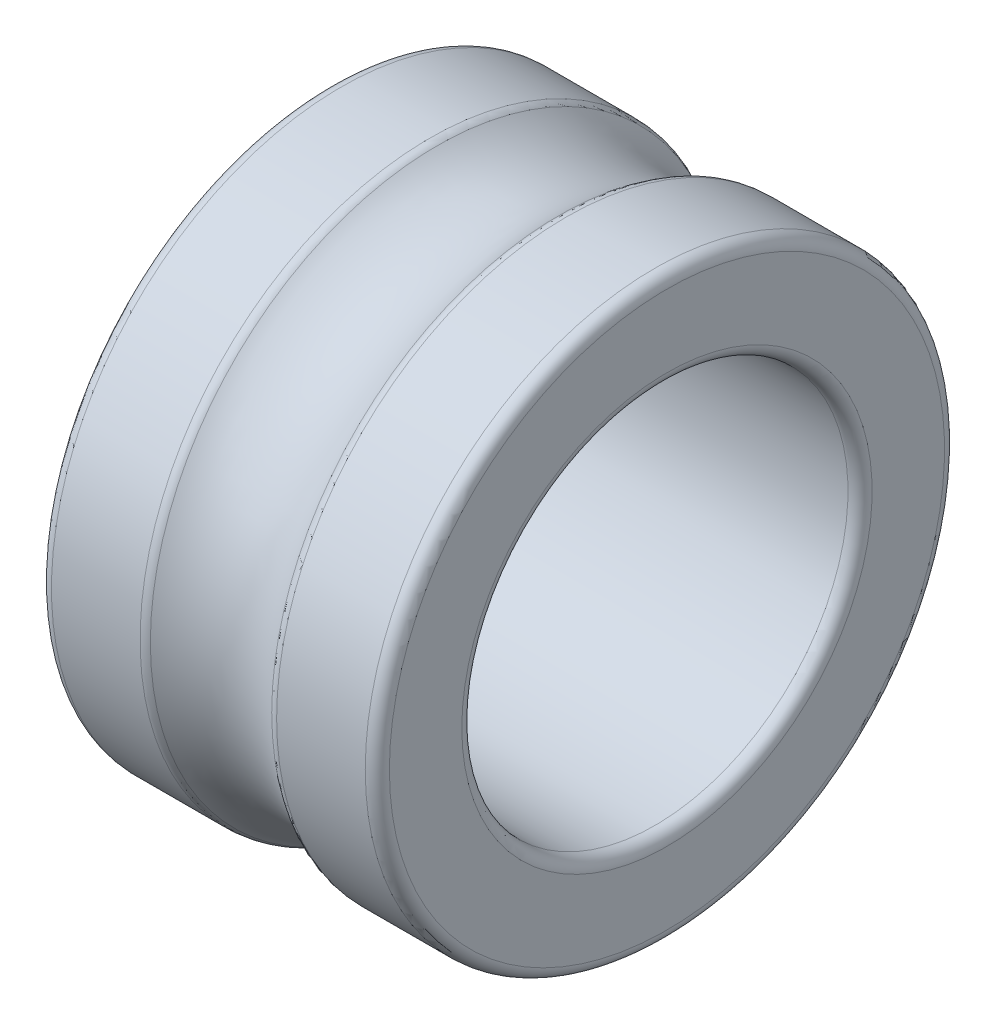
from build123d import *

# Parameters (mm, degrees)
CONG_1_R = 0.25


with BuildPart() as part:
    # Esquisse1 → Révolution1 (revolve)
    with BuildSketch(Plane.XY, mode=Mode.PRIVATE) as r_volution1_sk:
        with BuildLine():
            Line((1.322875656, 6), (3.5, 6))
            Line((3.5, 6), (3.5, 4))
            Line((3.5, 4), (-3.5, 4))
            Line((-3.5, 4), (-3.5, 6))
            Line((-3.5, 6), (-1.322875656, 6))
            ThreePointArc((-1.322875656, 6), (0, 5.5), (1.322875656, 6))
        make_face()
    revolve(r_volution1_sk.sketch.rotate(Axis((-31.667666126, 0, 0), (1, 0, 0)), 90), axis=Axis((-31.667666126, 0, 0), (1, 0, 0)))

    # Congé1
    cong_1_edges = [part.edges().sort_by_distance(p)[0] for p in [
        (1.322875656, 0, -6),
        (3.5, 0, -6),
        (3.5, 0, -4),
        (-3.5, 0, -4),
        (-3.5, 0, -6),
        (-1.322875656, 0, -6),
    ]]
    fillet(cong_1_edges, radius=CONG_1_R)


solid = part.part
